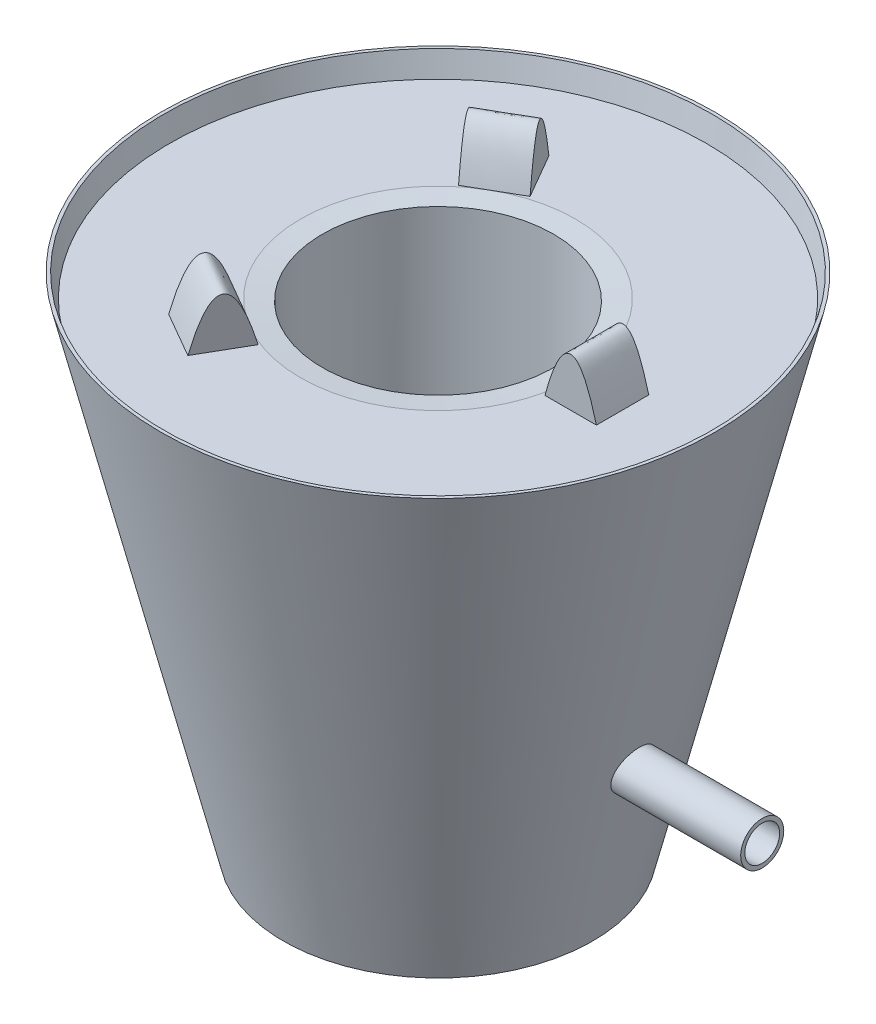
from build123d import *

# Parameters (mm, degrees)
SKETCH4_R                = 74.539741671
BOSS_EXTRUDE1_DEPTH      = 3
BOSS_EXTRUDE2_DEPTH      = 10
BOSS_EXTRUDE2_DEPTH_BACK = 100
SKETCH6_R                = 9.86749483
SKETCH6_R_2              = 7.976373773
BOSS_EXTRUDE3_START      = -10
BOSS_EXTRUDE3_DEPTH      = 24
CIRPATTERN1_COUNT        = 3


with BuildPart() as part:
    # Sketch3 → Revolve1 (revolve)
    with BuildSketch(Plane.XY, mode=Mode.PRIVATE) as revolve1_sk:
        Polygon((70.900866091, -230), (127, 0), (125.539552411, 0), (125.233772925, -1.259367766), (123.010793667, -10.414816558), (63.010793667, -10.414816558), (52.977887412, -11.398872193), (52.977887412, -105.415593626), (29.949462522, -105.415593626), (29.949462522, -165.415593626), (0, -165.415593626), (0, -167.021708731), (31.460670445, -167.021708731), (31.460670445, -106.724061506), (54.769662456, -106.724061506), (54.769662456, -11.398872193), (122.771861058, -11.398872193), (69.917529324, -229.08202231), (0, -229.08202231), (0, -230), align=None)
    revolve(revolve1_sk.sketch.rotate(Axis((0, -230, 0), (0, 1, 0)), 90), axis=Axis((0, -230, 0), (0, 1, 0)))

    # Sketch6 → Boss-Extrude2 (add, two sides: drawn at the far end of the back side and taken through both)
    with BuildSketch(Plane(origin=(138.5660593, 0, 0), x_dir=(0, 0, -1), z_dir=(1, 0, 0)).offset(-BOSS_EXTRUDE2_DEPTH_BACK)):
        with Locations(Location((0, -152.314004943, 0), (0, 0, 313.353855363))):
            Circle(SKETCH6_R)
        with Locations(Location((0, -152.314004943, 0), (0, 0, 301.915257185))):
            Circle(SKETCH6_R_2, mode=Mode.SUBTRACT)
    extrude(amount=BOSS_EXTRUDE2_DEPTH + BOSS_EXTRUDE2_DEPTH_BACK)

    # Sketch8 → Boss-Extrude3 (add)
    with BuildSketch(Plane.XY.offset(BOSS_EXTRUDE3_START)):
        with BuildLine():
            Line((86.588232218, -10.414816558), (63.010793667, -10.414816558))
            add(Edge.make_bspline(
                [(86.588232218, -10.414816558), (74.799512942, 34.067370185), (63.010793667, -10.414816558)],
                knots=[0, 0, 0, 1, 1, 1], degree=2))
        make_face()
    boss_extrude3 = extrude(amount=BOSS_EXTRUDE3_DEPTH)

    # CirPattern1: Boss-Extrude3 ×3 about axis
    cirpattern1_axis = Axis((0, -10.414816558, 0), (0, -1, 0))
    for i in range(1, CIRPATTERN1_COUNT):
        add(boss_extrude3.rotate(cirpattern1_axis, i * 360 / CIRPATTERN1_COUNT))


with BuildPart() as body_2:
    # Sketch4 → Boss-Extrude1 (new body)
    with BuildSketch(Plane(origin=(0, -200, 0), x_dir=(1, 0, 0), z_dir=(0, 1, 0))):
        with Locations(Location((0, 0, 0), (0, 0, 270))):
            Circle(SKETCH4_R)
    extrude(amount=BOSS_EXTRUDE1_DEPTH)


solid = Compound([part.part, body_2.part])
